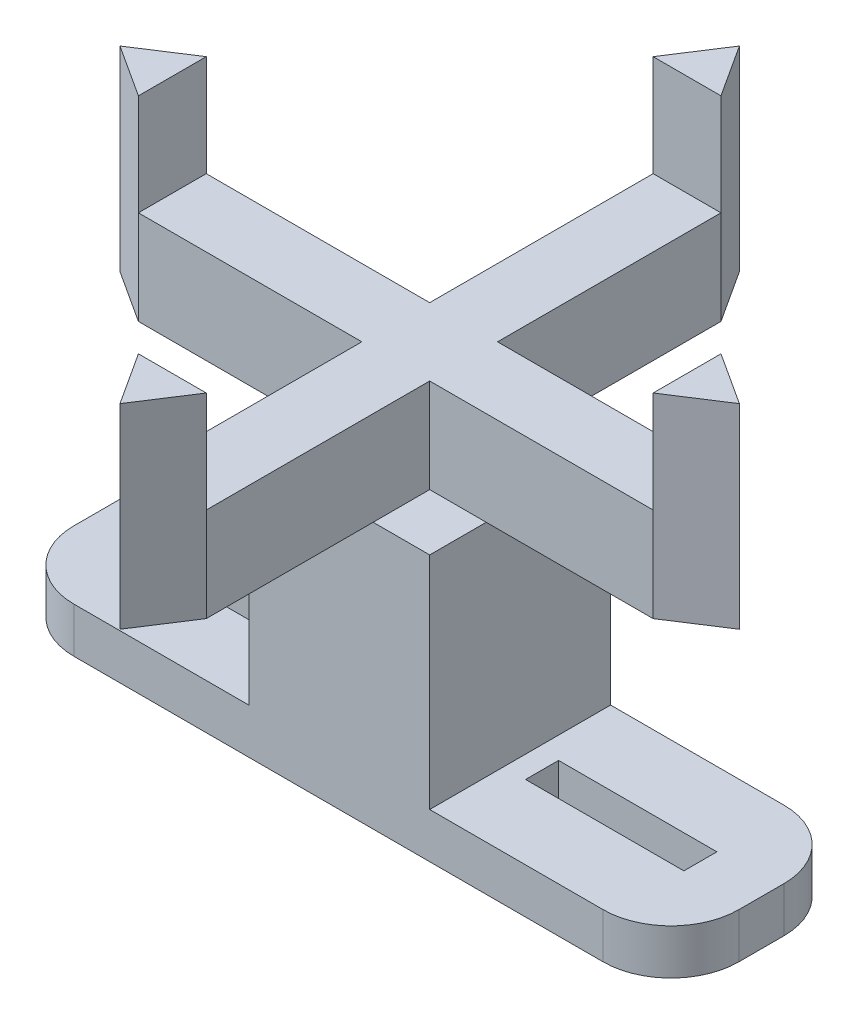
from build123d import *

# Parameters (mm, degrees)
SKETCH1_W           = 7
SKETCH1_H           = 1.46
BOSS_EXTRUDE2_DEPTH = 2
SKETCH2_W           = 8
SKETCH2_H           = 8
BOSS_EXTRUDE3_DEPTH = 9.74993
BOSS_EXTRUDE4_DEPTH = 4.16
BOSS_EXTRUDE5_DEPTH = 8.64081
SKETCH6_R           = 1.5
BOSS_EXTRUDE7_DEPTH = 0.5
CIRPATTERN2_COUNT   = 4


with BuildPart() as part:
    # Sketch1 → Boss-Extrude2 (new body)
    with BuildSketch(Plane(origin=(0, 0, 0), x_dir=(1, 0, 0), z_dir=(0, 1, 0))):
        with BuildLine():
            Line((-67.759015818, -5.626850133), (-44.359015818, -5.626850133))
            ThreePointArc((-44.359015818, -5.626850133), (-42.237695475, -6.50552979), (-41.359015818, -8.626850133))
            Line((-41.359015818, -8.626850133), (-41.359015818, -10.626850133))
            ThreePointArc((-41.359015818, -10.626850133), (-42.237695475, -12.748170477), (-44.359015818, -13.626850133))
            Line((-44.359015818, -13.626850133), (-67.759015818, -13.626850133))
            ThreePointArc((-67.759015818, -13.626850133), (-69.880336162, -12.748170477), (-70.759015818, -10.626850133))
            Line((-70.759015818, -10.626850133), (-70.759015818, -8.626850133))
            ThreePointArc((-70.759015818, -8.626850133), (-69.880336162, -6.50552979), (-67.759015818, -5.626850133))
        make_face()
        with Locations((-64.559015818, -9.626850133)):
            Rectangle(SKETCH1_W, SKETCH1_H, mode=Mode.SUBTRACT)
        with Locations((-47.559015818, -9.626850133)):
            Rectangle(SKETCH1_W, SKETCH1_H, mode=Mode.SUBTRACT)
    extrude(amount=BOSS_EXTRUDE2_DEPTH)

    # Sketch2 → Boss-Extrude3 (add)
    with BuildSketch(Plane(origin=(0, 2, 0), x_dir=(1, 0, 0), z_dir=(0, 1, 0))):
        with Locations((-56.028566074, -9.626850133)):
            Rectangle(SKETCH2_W, SKETCH2_H)
    extrude(amount=BOSS_EXTRUDE3_DEPTH)

    # Sketch3 → Boss-Extrude4 (add)
    with BuildSketch(Plane(origin=(0, 11.74993, 0), x_dir=(1, 0, 0), z_dir=(0, 1, 0))):
        Polygon((-67.408566074, -8.126850133), (-57.528566074, -8.126850133), (-57.528566074, 1.753149867), (-54.528566074, 1.753149867), (-54.528566074, -8.126850133), (-44.648566074, -8.126850133), (-44.648566074, -11.126850133), (-54.528566074, -11.126850133), (-54.528566074, -21.006850133), (-57.528566074, -21.006850133), (-57.528566074, -11.126850133), (-67.408566074, -11.126850133), align=None)
    extrude(amount=BOSS_EXTRUDE4_DEPTH)

    # Sketch4 → Boss-Extrude5 (add)
    with BuildSketch(Plane(origin=(0, 11.74993, 0), x_dir=(1, 0, 0), z_dir=(0, 1, 0))):
        Polygon((-67.408566074, -8.126850133), (-69.723836074, -9.626850133), (-67.408566074, -11.126850133), align=None)
    boss_extrude5 = extrude(amount=BOSS_EXTRUDE5_DEPTH)

    # Sketch6 → Boss-Extrude7 (add)
    with BuildSketch(Plane(origin=(0, 0, 0), x_dir=(1, 0, 0), z_dir=(0, 1, 0))):
        with Locations((-56.028566074, -9.626850133)):
            Circle(SKETCH6_R)
    extrude(amount=BOSS_EXTRUDE7_DEPTH)

    # CirPattern2: Boss-Extrude5 ×4 about axis
    cirpattern2_axis = Axis((-56.028566074, 0, 9.626850133), (0, 1, 0))
    for i in range(1, CIRPATTERN2_COUNT):
        add(boss_extrude5.rotate(cirpattern2_axis, i * 360 / CIRPATTERN2_COUNT))


solid = part.part
